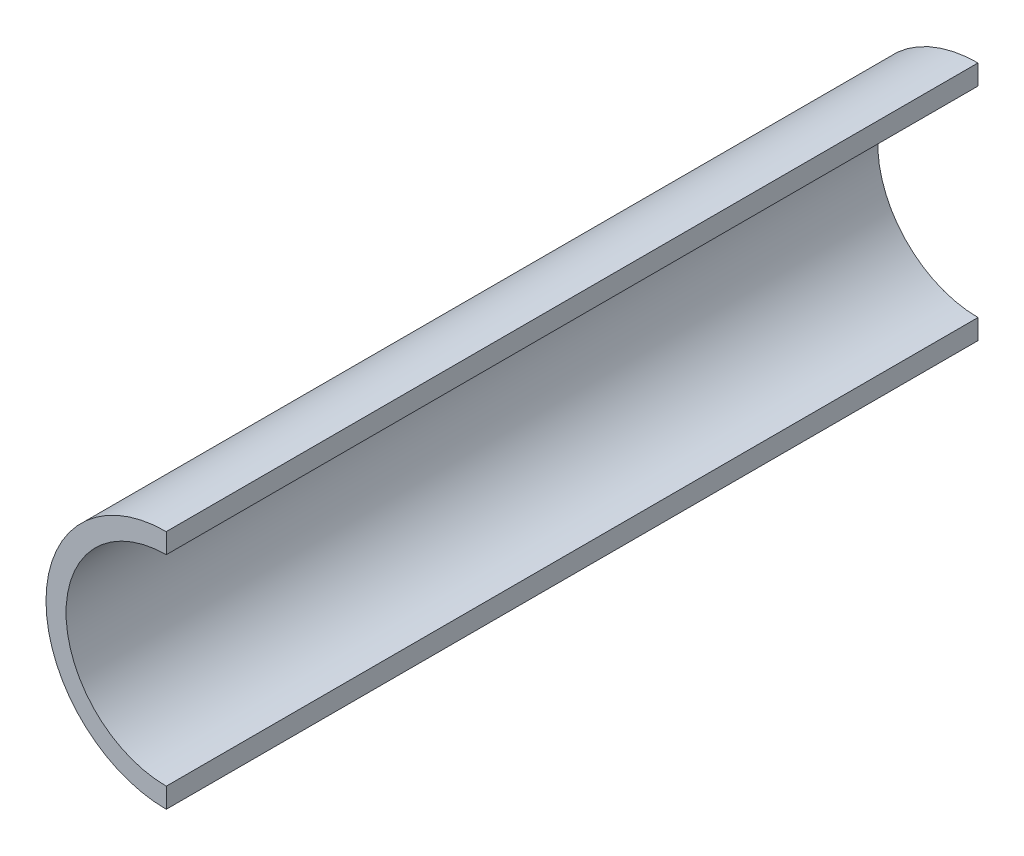
from build123d import *

# Parameters (mm, degrees)
BOSS_EXTRUDE1_DEPTH = 64.29502


with BuildPart() as part:
    # Sketch1 → Boss-Extrude1 (new body)
    with BuildSketch(Plane.XY):
        with BuildLine():
            Line((0, 9.525), (0, 7.9375))
            ThreePointArc((0, 7.9375), (-7.9375, 0), (0, -7.9375))
            Line((0, -7.9375), (0, -9.525))
            ThreePointArc((0, -9.525), (-9.525, 0), (0, 9.525))
        make_face()
    extrude(amount=BOSS_EXTRUDE1_DEPTH)


solid = part.part
